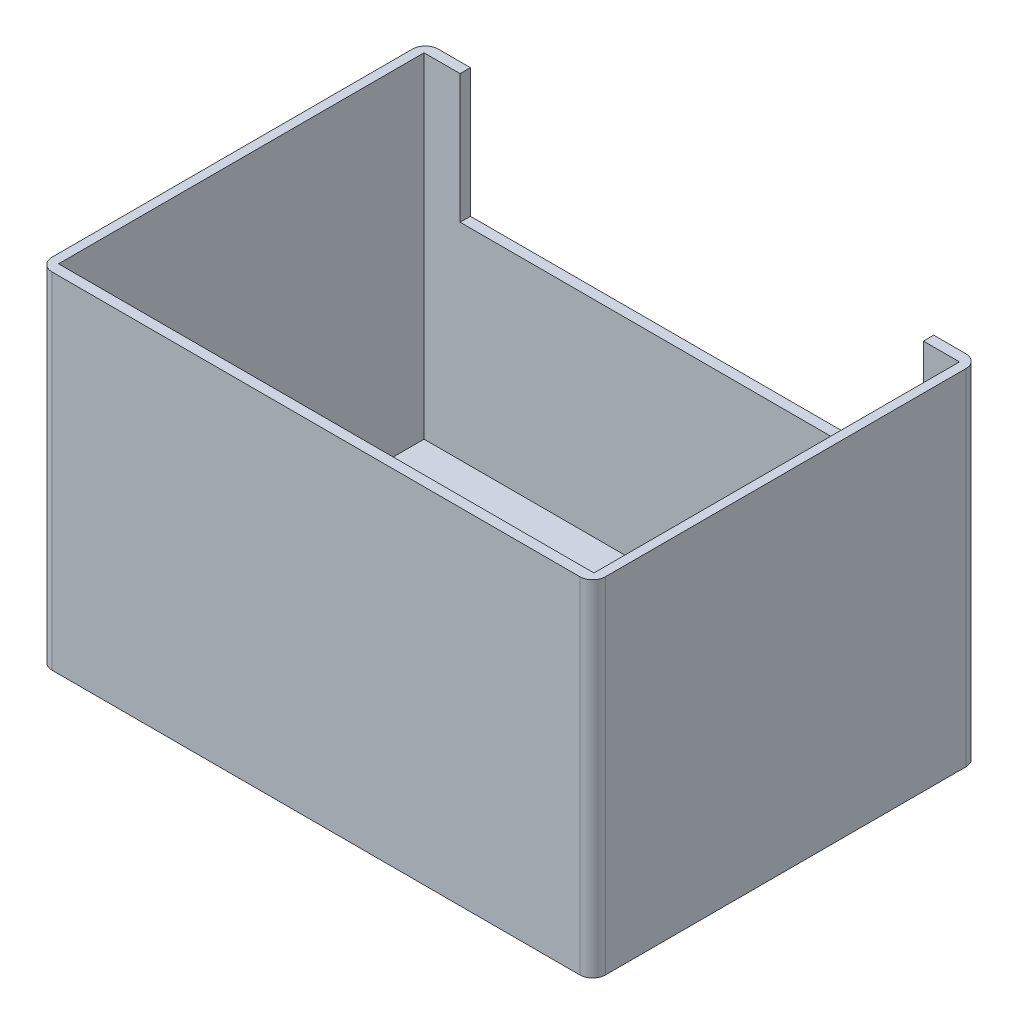
from build123d import *

# Parameters (mm, degrees)
SKETCH1_W           = 215
SKETCH1_H           = 150
BOSS_EXTRUDE1_DEPTH = 4
SKETCH2_W           = 215
SKETCH2_H           = 150
SKETCH2_W_2         = 208
SKETCH2_H_2         = 142
BOSS_EXTRUDE2_DEPTH = 130
SKETCH4_W           = 180
SKETCH4_H           = 50
CUT_EXTRUDE1_DEPTH  = 6
FILLET1_R           = 5
FILLET2_R           = 5
FILLET3_R           = 5
FILLET4_R           = 5
SKETCH6_R           = 2.25
CUT_EXTRUDE2_DEPTH  = 6


with BuildPart() as part:
    # Sketch1 → Boss-Extrude1 (new body)
    with BuildSketch(Plane(origin=(0, 0, 0), x_dir=(1, 0, 0), z_dir=(0, 1, 0))):
        with Locations((0, 5)):
            Rectangle(SKETCH1_W, SKETCH1_H)
    extrude(amount=BOSS_EXTRUDE1_DEPTH)

    # Sketch2 → Boss-Extrude2 (add)
    with BuildSketch(Plane(origin=(0, 4, 0), x_dir=(1, 0, 0), z_dir=(0, 1, 0))):
        with Locations((0, 5)):
            Rectangle(SKETCH2_W, SKETCH2_H)
        with Locations((0, 5)):
            Rectangle(SKETCH2_W_2, SKETCH2_H_2, mode=Mode.SUBTRACT)
    extrude(amount=BOSS_EXTRUDE2_DEPTH)

    # Sketch4 → Cut-Extrude1 (cut)
    with BuildSketch(Plane(origin=(0, 0, -80), x_dir=(-1, 0, 0), z_dir=(0, 0, -1))):
        with Locations((0, 109)):
            Rectangle(SKETCH4_W, SKETCH4_H)
    extrude(amount=-CUT_EXTRUDE1_DEPTH, mode=Mode.SUBTRACT)

    # Fillet1
    fillet1_edges = [part.edges().sort_by_distance(p)[0] for p in [
        (-107.5, 67, -80),
    ]]
    fillet(fillet1_edges, radius=FILLET1_R)

    # Fillet2
    fillet2_edges = [part.edges().sort_by_distance(p)[0] for p in [
        (107.5, 67, -80),
    ]]
    fillet(fillet2_edges, radius=FILLET2_R)

    # Fillet3
    fillet3_edges = [part.edges().sort_by_distance(p)[0] for p in [
        (-107.5, 67, 70),
    ]]
    fillet(fillet3_edges, radius=FILLET3_R)

    # Fillet4
    fillet4_edges = [part.edges().sort_by_distance(p)[0] for p in [
        (107.5, 67, 70),
    ]]
    fillet(fillet4_edges, radius=FILLET4_R)

    # Sketch6 → Cut-Extrude2 (cut)
    with BuildSketch(Plane(origin=(0, 0, 0), x_dir=(-1, 0, 0), z_dir=(0, -1, 0))):
        with Locations(Location((15, -20, 0), (0, 0, 90))):
            Circle(SKETCH6_R)
        with Locations(Location((-15, -40, 0), (0, 0, 90))):
            Circle(SKETCH6_R)
        with Locations(Location((15, 0, 0), (0, 0, 90))):
            Circle(SKETCH6_R)
        with Locations(Location((-15, -20, 0), (0, 0, 90))):
            Circle(SKETCH6_R)
        with Locations(Location((15, 20, 0), (0, 0, 90))):
            Circle(SKETCH6_R)
        with Locations(Location((-15, 20, 0), (0, 0, 90))):
            Circle(SKETCH6_R)
        with Locations(Location((15, -40, 0), (0, 0, 90))):
            Circle(SKETCH6_R)
        with Locations(Location((-15, 0, 0), (0, 0, 90))):
            Circle(SKETCH6_R)
    extrude(amount=-CUT_EXTRUDE2_DEPTH, mode=Mode.SUBTRACT)


solid = part.part
